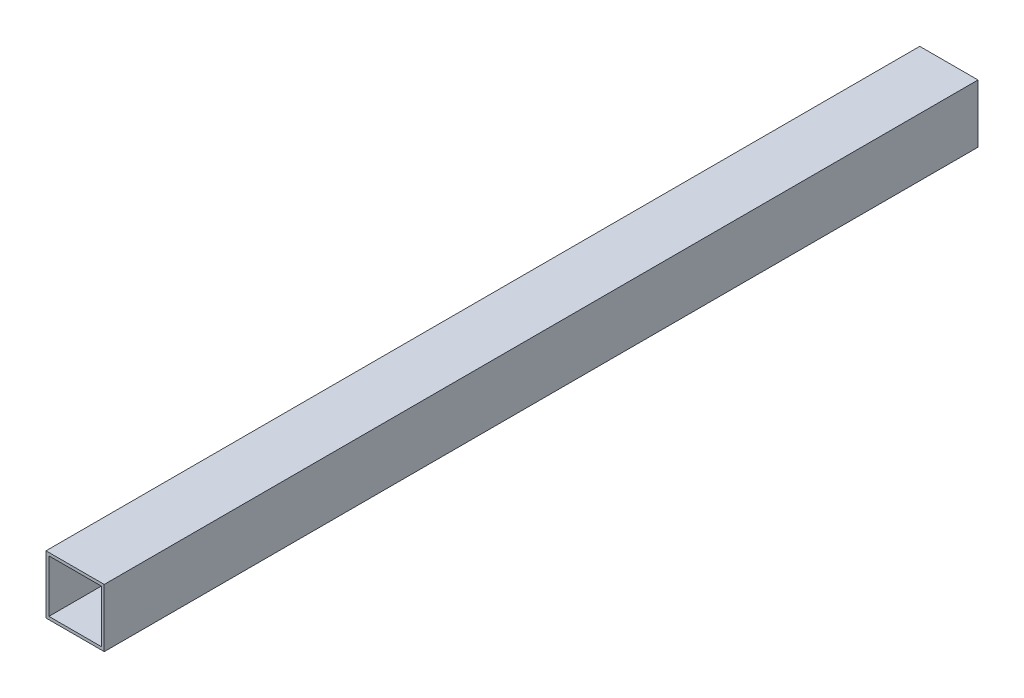
from build123d import *

# Parameters (mm, degrees)
SKETCH_1_W      = 20
SKETCH_1_H      = 20
SKETCH_1_W_2    = 18
SKETCH_1_H_2    = 18
EXTRUDE_1_DEPTH = 150
SKETCH_2_W      = 20
SKETCH_2_H      = 20
SKETCH_2_W_2    = 18
SKETCH_2_H_2    = 18
EXTRUDE_2_DEPTH = 150


with BuildPart() as part:
    # 草图1 → 凸台-拉伸1 (new body)
    with BuildSketch(Plane.XY):
        Rectangle(SKETCH_1_W, SKETCH_1_H)
        Rectangle(SKETCH_1_W_2, SKETCH_1_H_2, mode=Mode.SUBTRACT)
    extrude(amount=EXTRUDE_1_DEPTH)

    # 草图2 → 凸台-拉伸2 (add)
    with BuildSketch(Plane.XY.offset(150)):
        Rectangle(SKETCH_2_W, SKETCH_2_H)
        Rectangle(SKETCH_2_W_2, SKETCH_2_H_2, mode=Mode.SUBTRACT)
    extrude(amount=EXTRUDE_2_DEPTH)


solid = part.part
